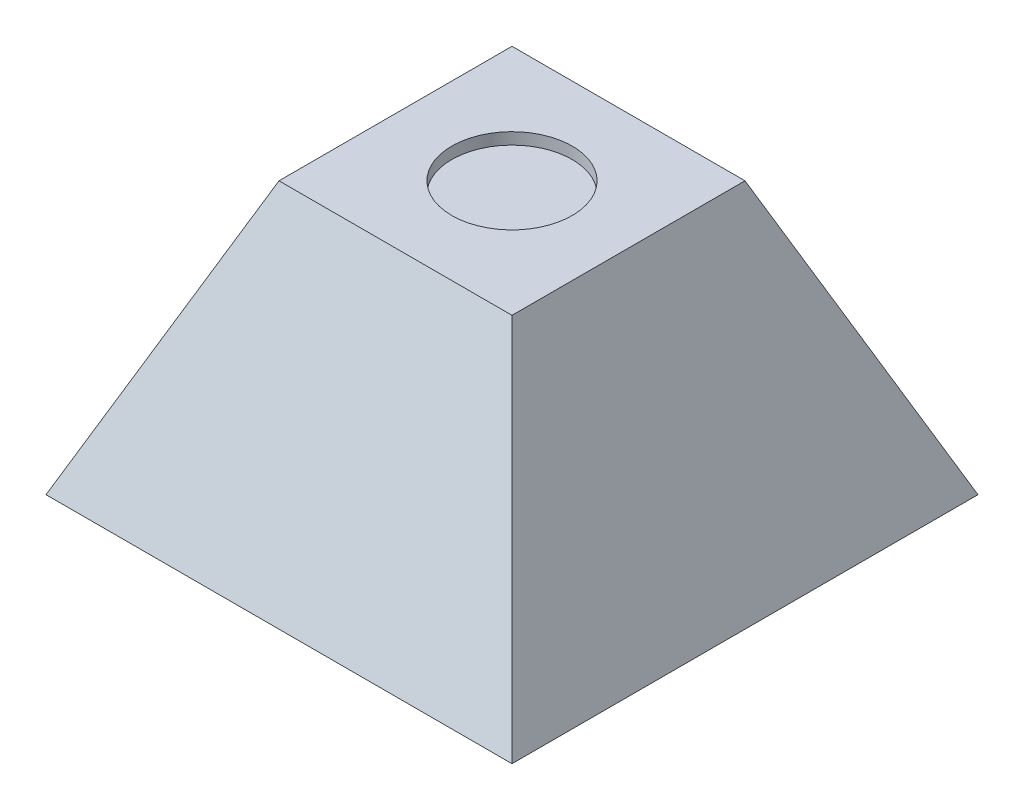
from build123d import *

# Parameters (mm, degrees)
SKETCH_3_R          = 15.5
CUT_EXTRUDE_1_DEPTH = 3


with BuildPart() as part:
    # 草图2 → 放样1 section 0
    with BuildSketch(Plane(origin=(0, 70, 0), x_dir=(1, 0, 0), z_dir=(0, 1, 0))):
        with BuildLine():
            Line((-30, -30), (30, -30))
            Line((30, -30), (30, 30))
            Line((30, 30), (-30, 30))
            Line((-30, 30), (-30, -30))
        make_face()
    # 草图1 → 放样1 section 1
    with BuildSketch(Plane(origin=(0, 0, 0), x_dir=(1, 0, 0), z_dir=(0, 1, 0))):
        with BuildLine():
            Line((-60, -60), (60, -60))
            Line((60, -60), (60, 60))
            Line((60, 60), (-60, 60))
            Line((-60, 60), (-60, -60))
        make_face()
    loft()

    # 草图3 → 切除-拉伸1 (cut)
    with BuildSketch(Plane(origin=(0, 70, 0), x_dir=(1, 0, 0), z_dir=(0, 1, 0))):
        with Locations(Location((0, 0, 0), (0, 0, 270))):
            Circle(SKETCH_3_R)
    extrude(amount=-CUT_EXTRUDE_1_DEPTH, mode=Mode.SUBTRACT)


solid = part.part
